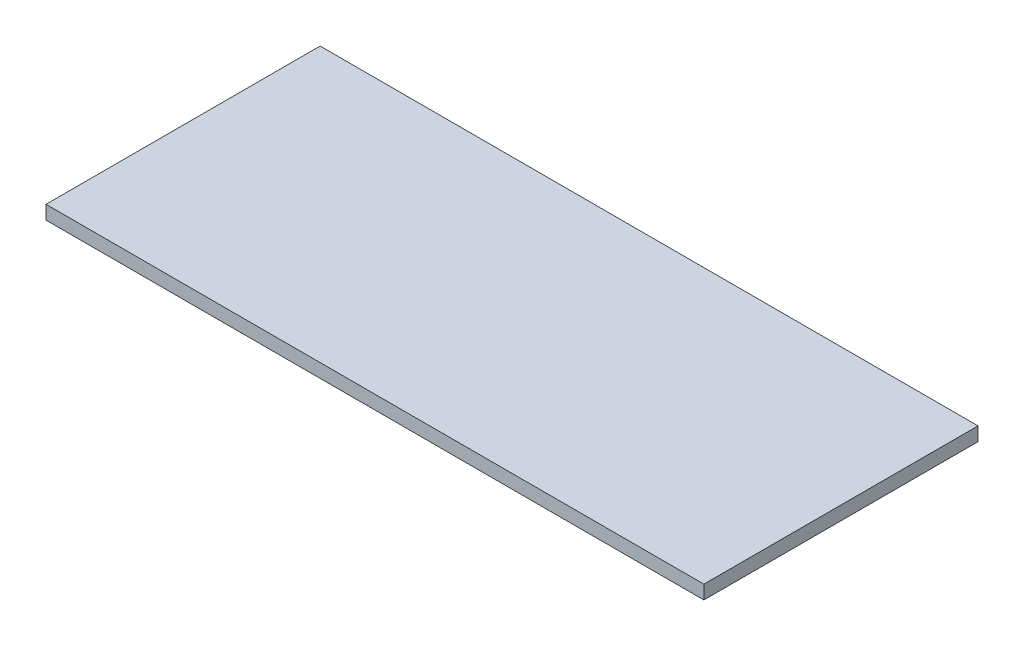
from build123d import *

# Parameters (mm, degrees)
SKETCH1_W           = 1200
SKETCH1_H           = 500
BOSS_EXTRUDE1_DEPTH = 25


with BuildPart() as part:
    # Sketch1 → Boss-Extrude1 (new body)
    with BuildSketch(Plane(origin=(0, 0, 0), x_dir=(1, 0, 0), z_dir=(0, 1, 0))):
        with Locations((519.441570425, -215.86411902)):
            Rectangle(SKETCH1_W, SKETCH1_H)
    extrude(amount=BOSS_EXTRUDE1_DEPTH)


solid = part.part
